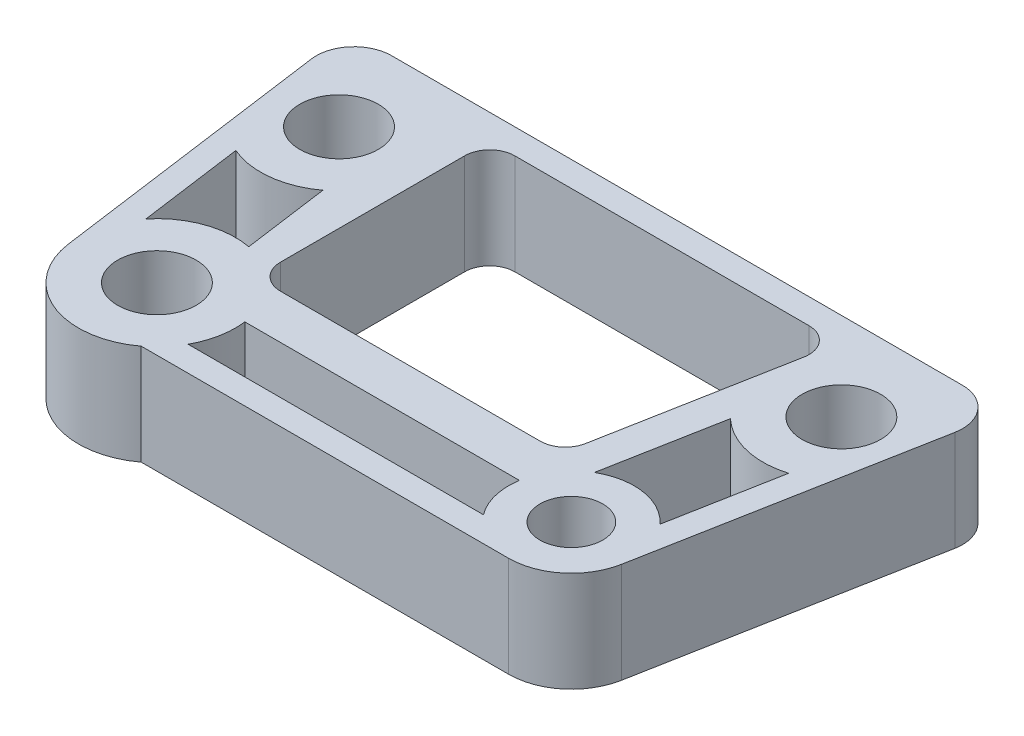
from build123d import *

# Parameters (mm, degrees)
SKETCH4_R           = 3.96875
SKETCH4_R_2         = 3.175
BOSS_EXTRUDE2_DEPTH = 10.16
FILLET1_R           = 3.81


with BuildPart() as part:
    # Sketch4 → Boss-Extrude2 (new body)
    with BuildSketch(Plane(origin=(0, 0, 0), x_dir=(1, 0, 0), z_dir=(0, 1, 0))):
        with BuildLine():
            Line((54.2925, 31.75), (-12.3825, 31.75))
            Line((-12.3825, 31.75), (-7.863361559, -1.082336008))
            ThreePointArc((-7.863361559, -1.082336008), (-3.056289676, -7.325503373), (4.7625, -6.35))
            Line((4.7625, -6.35), (41.91, -6.35))
            ThreePointArc((41.91, -6.35), (45.967580476, -4.884520517), (48.152310263, -1.164501002))
            Line((48.152310263, -1.164501002), (54.2925, 31.75))
        make_face()
        with Locations(Location((0, 0, 0), (0, 0, 270))):
            Circle(SKETCH4_R, mode=Mode.SUBTRACT)
        with Locations(Location((46.355, 22.86, 0), (0, 0, 270))):
            Circle(SKETCH4_R, mode=Mode.SUBTRACT)
        with Locations(Location((-4.445, 22.86, 0), (0, 0, 270))):
            Circle(SKETCH4_R, mode=Mode.SUBTRACT)
        with Locations(Location((41.91, 0, 0), (0, 0, 270))):
            Circle(SKETCH4_R_2, mode=Mode.SUBTRACT)
        with BuildLine():
            Line((36.730478204, 29.21), (6.985, 29.21))
            ThreePointArc((6.985, 29.21), (5.188948776, 28.466051224), (4.445, 26.67))
            Line((4.445, 26.67), (4.445, 8.043333333))
            ThreePointArc((4.445, 8.043333333), (5.188948776, 6.247282109), (6.985, 5.503333333))
            Line((6.985, 5.503333333), (33.255679437, 5.503333333))
            ThreePointArc((33.255679437, 5.503333333), (34.878711627, 6.089525126), (35.752603542, 7.577532932))
            Line((35.752603542, 7.577532932), (39.227402309, 26.204199599))
            ThreePointArc((39.227402309, 26.204199599), (38.684286411, 28.29303219), (36.730478204, 29.21))
        make_face(mode=Mode.SUBTRACT)
        with BuildLine():
            Line((46.58698696, 4.295147609), (48.631735848, 15.256028661))
            ThreePointArc((48.631735848, 15.256028661), (44.519378774, 15.137668683), (40.900146495, 17.093850549))
            Line((40.900146495, 17.093850549), (38.737442476, 5.500670755))
            ThreePointArc((38.737442476, 5.500670755), (42.873923491, 6.276412312), (46.58698696, 4.295147609))
        make_face(mode=Mode.SUBTRACT)
        with BuildLine():
            Line((36.83, -3.81), (6.963318623, -3.81))
            ThreePointArc((6.963318623, -3.81), (7.800370345, -1.469057088), (7.872207457, 1.016))
            Line((7.872207457, 1.016), (35.641806959, 1.016))
            ThreePointArc((35.641806959, 1.016), (35.744131016, -1.518077625), (36.83, -3.81))
        make_face(mode=Mode.SUBTRACT)
        with BuildLine():
            Line((-6.14066773, 5.029523445), (-7.591897143, 15.572960504))
            ThreePointArc((-7.591897143, 15.572960504), (-3.525796009, 14.975903966), (0.293891225, 16.492361803))
            Line((0.293891225, 16.492361803), (1.490851578, 7.796234208))
            ThreePointArc((1.490851578, 7.796234208), (-2.705340953, 7.462240721), (-6.14066773, 5.029523445))
        make_face(mode=Mode.SUBTRACT)
    extrude(amount=BOSS_EXTRUDE2_DEPTH)

    # Fillet1
    fillet1_edges = [part.edges().sort_by_distance(p)[0] for p in [
        (-12.3825, 5.08, -31.75),
        (54.2925, 5.08, -31.75),
    ]]
    fillet(fillet1_edges, radius=FILLET1_R)


solid = part.part
